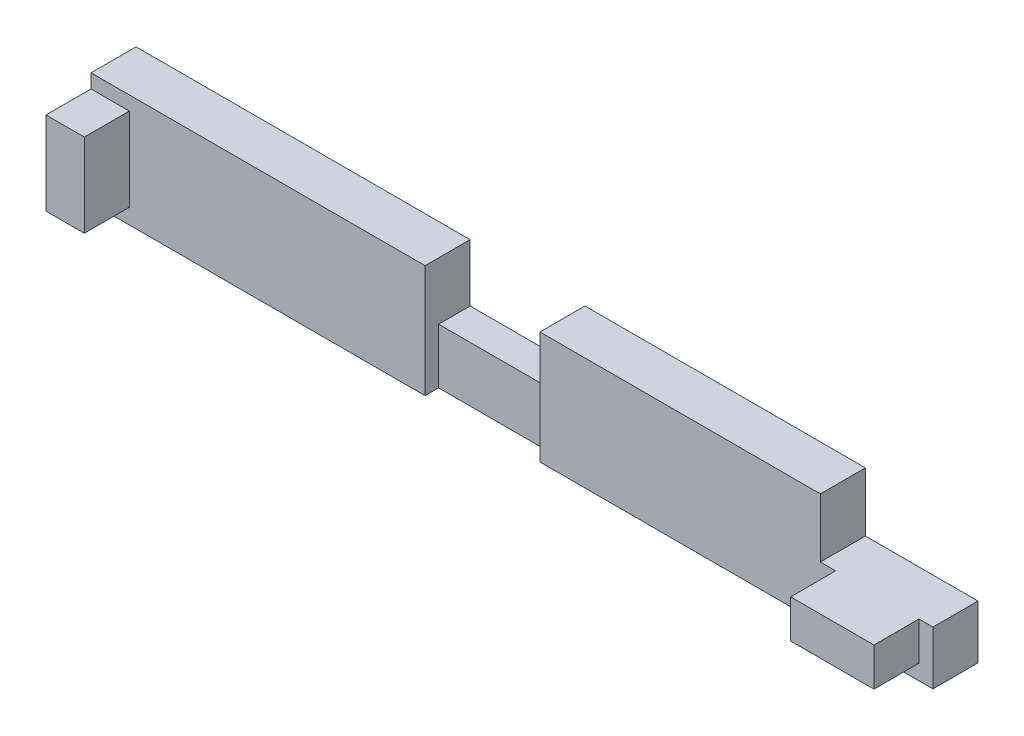
from build123d import *

# Parameters (mm, degrees)
SKETCH1_W           = 200
SKETCH1_H           = 25
BOSS_EXTRUDE1_DEPTH = 10
SKETCH4_W           = 25.5
SKETCH4_H           = 25.5
CUT_EXTRUDE2_DEPTH  = 10
SKETCH2_W           = 18.5
SKETCH2_H           = 8.5
SKETCH2_W_2         = 8.5
SKETCH2_H_2         = 18.5
BOSS_EXTRUDE3_DEPTH = 10
SKETCH3_W           = 13.1
SKETCH3_H           = 25
SKETCH3_W_2         = 25
SKETCH3_H_2         = 13.1
CUT_EXTRUDE3_DEPTH  = 10
SKETCH5_W           = 25.5
SKETCH5_H           = 3
CUT_EXTRUDE4_DEPTH  = 13


with BuildPart() as part:
    # Sketch1 → Boss-Extrude1 (new body)
    with BuildSketch(Plane.XY):
        with Locations((100, 12.5)):
            Rectangle(SKETCH1_W, SKETCH1_H)
    extrude(amount=BOSS_EXTRUDE1_DEPTH)

    # Sketch4 → Cut-Extrude2 (cut)
    with BuildSketch(Plane.XY.offset(10)):
        with Locations((100, 25)):
            Rectangle(SKETCH4_W, SKETCH4_H)
    extrude(amount=-CUT_EXTRUDE2_DEPTH, mode=Mode.SUBTRACT)

    # Sketch2 → Boss-Extrude3 (add)
    with BuildSketch(Plane.XY.offset(10)):
        with Locations((187.65, 7.65)):
            Rectangle(SKETCH2_W, SKETCH2_H)
        with Locations((17.35, 12.65)):
            Rectangle(SKETCH2_W_2, SKETCH2_H_2)
    extrude(amount=BOSS_EXTRUDE3_DEPTH)

    # Sketch3 → Cut-Extrude3 (cut)
    with BuildSketch(Plane.XY.offset(10)):
        with Locations((6.55, 12.5)):
            Rectangle(SKETCH3_W, SKETCH3_H)
        with Locations((187.5, 18.45)):
            Rectangle(SKETCH3_W_2, SKETCH3_H_2)
    extrude(amount=-CUT_EXTRUDE3_DEPTH, mode=Mode.SUBTRACT)

    # Sketch5 → Cut-Extrude4 (cut)
    with BuildSketch(Plane(origin=(0, 12.25, 0), x_dir=(1, 0, 0), z_dir=(0, 1, 0))):
        with Locations((100, -8.5)):
            Rectangle(SKETCH5_W, SKETCH5_H)
    extrude(amount=-CUT_EXTRUDE4_DEPTH, mode=Mode.SUBTRACT)


solid = part.part
